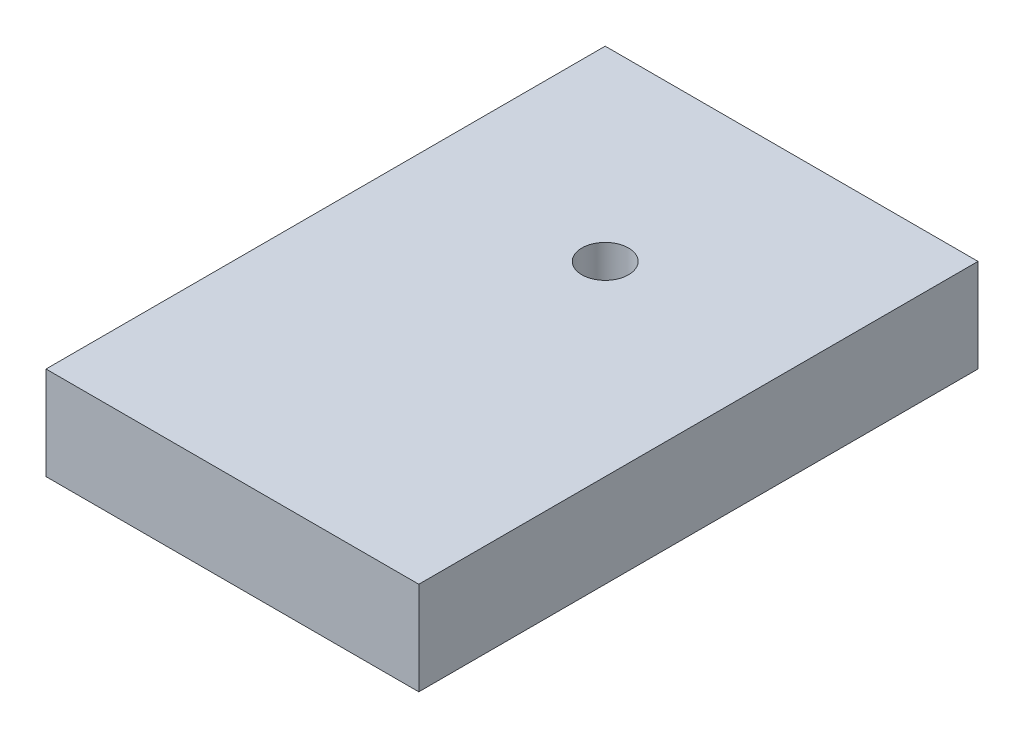
from build123d import *

# Parameters (mm, degrees)
SKETCH1_W           = 25.4
SKETCH1_H           = 38.1
SKETCH1_R           = 1.5875
BOSS_EXTRUDE1_DEPTH = 6.35


with BuildPart() as part:
    # Sketch1 → Boss-Extrude1 (new body)
    with BuildSketch(Plane(origin=(0, 0, 0), x_dir=(1, 0, 0), z_dir=(0, 1, 0))):
        with Locations((12.7, -19.05)):
            Rectangle(SKETCH1_W, SKETCH1_H)
        with Locations(Location((12.7, -12.7, 0), (0, 0, 270))):
            Circle(SKETCH1_R, mode=Mode.SUBTRACT)
    extrude(amount=BOSS_EXTRUDE1_DEPTH)


solid = part.part
